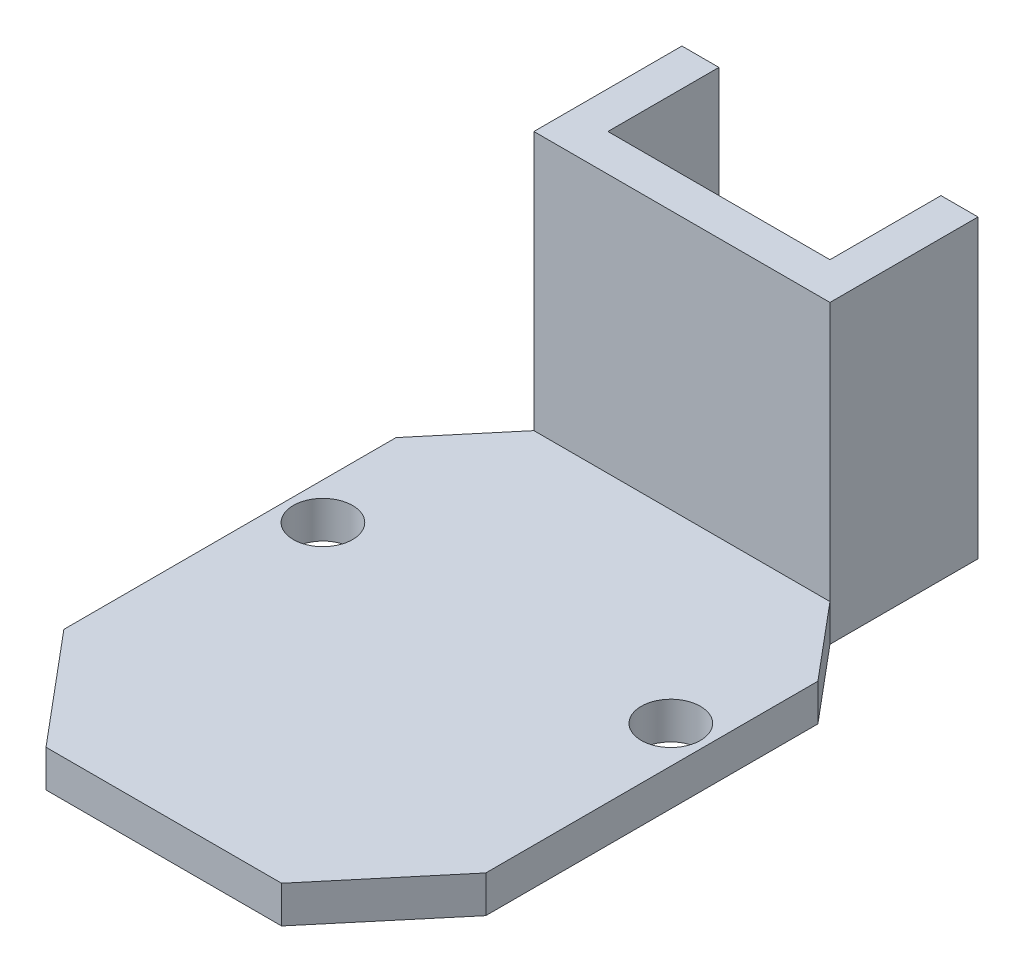
from build123d import *
from OCP.BRepFilletAPI import BRepFilletAPI_MakeChamfer

# Parameters (mm, degrees)
SKETCH1_W           = 40
SKETCH1_H           = 40
BOSS_EXTRUDE1_DEPTH = 20
SKETCH2_W           = 30
SKETCH2_H           = 40
CUT_EXTRUDE1_DEPTH  = 15
SKETCH3_W           = 57
SKETCH3_H           = 5
BOSS_EXTRUDE2_DEPTH = 70
DRAFT1_ANGLE        = 50
DRAFT2_ANGLE        = 50
CHAMFER1_SIZE       = 15
CHAMFER1_SIZE2      = 12.586494468
SKETCH6_R           = 4
CUT_EXTRUDE3_DEPTH  = 109.061325182


with BuildPart() as part:
    # Sketch1 → Boss-Extrude1 (new body)
    with BuildSketch(Plane.XY):
        with Locations((20, 20)):
            Rectangle(SKETCH1_W, SKETCH1_H)
    extrude(amount=BOSS_EXTRUDE1_DEPTH)

    # Sketch2 → Cut-Extrude1 (cut)
    with BuildSketch(Plane(origin=(0, 0, 0), x_dir=(-1, 0, 0), z_dir=(0, 0, -1))):
        with Locations((-20, 20)):
            Rectangle(SKETCH2_W, SKETCH2_H)
    extrude(amount=-CUT_EXTRUDE1_DEPTH, mode=Mode.SUBTRACT)

    # Sketch3 → Boss-Extrude2 (add)
    with BuildSketch(Plane.XY.offset(20)):
        with Locations((20, 2.5)):
            Rectangle(SKETCH3_W, SKETCH3_H)
    extrude(amount=BOSS_EXTRUDE2_DEPTH)

    # Draft1
    draft1_faces = [part.faces().sort_by_distance(p)[0] for p in [
        (-4.25, 2.5, 20),
    ]]
    draft(draft1_faces, Plane(origin=(0, 0, 20), x_dir=(0, 0, -1), z_dir=(-1, 0, 0)), DRAFT1_ANGLE)

    # Draft2
    draft2_faces = [part.faces().sort_by_distance(p)[0] for p in [
        (44.25, 2.5, 20),
    ]]
    draft(draft2_faces, Plane(origin=(40, 40, 20), x_dir=(0, 1, 0), z_dir=(1, 0, 0)), DRAFT2_ANGLE)

    # Chamfer1: one chamfer whose edges measure the first distance from different faces: ONE call of the kernel's chamfer builder (chamfer() names one face for all edges)
    chamfer1_edges_1 = [part.edges().sort_by_distance(p)[0] for p in [
        (-8.5, 2.5, 90),
    ]]
    chamfer1_side_1 = [part.faces().sort_by_distance(p)[0] for p in [
        (-8.5, 2.5, 60.064952769),
    ]]
    chamfer1_edges_2 = [part.edges().sort_by_distance(p)[0] for p in [
        (48.5, 2.5, 90),
    ]]
    chamfer1_side_2 = [part.faces().sort_by_distance(p)[0] for p in [
        (48.5, 2.5, 60.064952769),
    ]]
    chamfer1 = BRepFilletAPI_MakeChamfer(part.part.solid().wrapped)
    for e in chamfer1_edges_1:
        chamfer1.Add(CHAMFER1_SIZE, CHAMFER1_SIZE2, e.wrapped, chamfer1_side_1[0].wrapped)  # the first distance lies on this face
    for e in chamfer1_edges_2:
        chamfer1.Add(CHAMFER1_SIZE, CHAMFER1_SIZE2, e.wrapped, chamfer1_side_2[0].wrapped)  # the first distance lies on this face
    add(Compound.cast(chamfer1.Shape()), mode=Mode.REPLACE)

    # Sketch6 → Cut-Extrude3 (cut, through all)
    with BuildSketch(Plane(origin=(0, 5, 0), x_dir=(1, 0, 0), z_dir=(0, 1, 0))):
        with Locations(Location((-3.5, -45, 0), (0, 0, 270))):
            Circle(SKETCH6_R)
        with Locations(Location((43.5, -45, 0), (0, 0, 90))):
            Circle(SKETCH6_R)
    extrude(amount=-CUT_EXTRUDE3_DEPTH, mode=Mode.SUBTRACT)


solid = part.part
